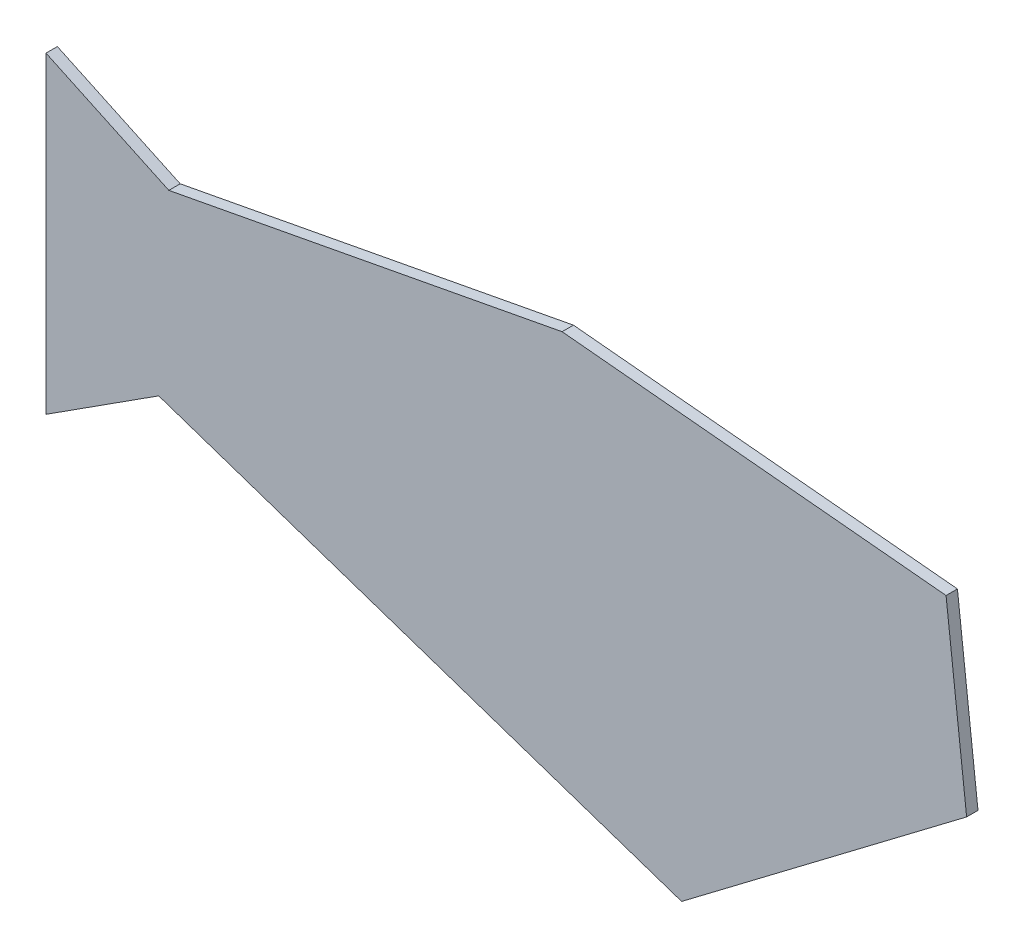
from build123d import *

# Parameters (mm, degrees)
EXTRUDE_1_DEPTH = 1


with BuildPart() as part:
    # Эскиз1 → Бобышка-Вытянуть1 (new body)
    with BuildSketch(Plane(origin=(-2.442787328, 0.015535996, 0), x_dir=(1, 0, 0), z_dir=(0, 0, 1))):
        Polygon((-32.435028221, 12.638264987), (-32.435028221, -14.873880267), (-22.520474354, -8.510808382), (23.466013495, -24.024322355), (48.529889407, -5.057064908), (46.72132151, 10.906397278), (12.950783427, 14.113418795), (-21.631501413, 7.585973619), align=None)
    extrude(amount=EXTRUDE_1_DEPTH)


solid = part.part
